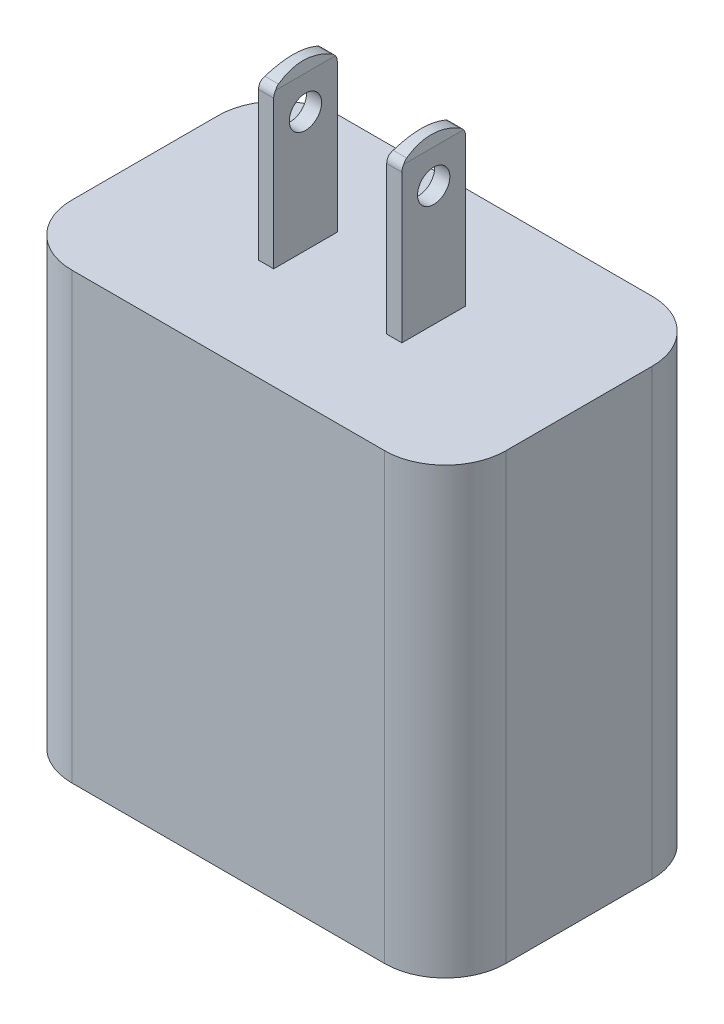
from build123d import *

# Parameters (mm, degrees)
SKETCH2_W           = 43
SKETCH2_H           = 26.5
BOSS_EXTRUDE1_DEPTH = 44
SKETCH3_W           = 12.2
SKETCH3_H           = 4.8
CUT_EXTRUDE1_DEPTH  = 10
SKETCH4_W           = 1.5
SKETCH4_H           = 6.3
BOSS_EXTRUDE2_DEPTH = 16.2
SKETCH5_R           = 1.6
CUT_EXTRUDE2_DEPTH  = 16.2
CUT_EXTRUDE3_DEPTH  = 16.2
CUT_EXTRUDE4_DEPTH  = 16.2
FILLET1_R           = 1
FILLET2_R           = 6
SKETCH8_W           = 10.2
SKETCH8_H           = 1.5
BOSS_EXTRUDE3_DEPTH = 9
CHAMFER1_SIZE       = 0.4


with BuildPart() as part:
    # Sketch2 → Boss-Extrude1 (new body)
    with BuildSketch(Plane(origin=(0, 0, 0), x_dir=(1, 0, 0), z_dir=(0, 1, 0))):
        Rectangle(SKETCH2_W, SKETCH2_H)
    extrude(amount=BOSS_EXTRUDE1_DEPTH)

    # Sketch3 → Cut-Extrude1 (cut)
    with BuildSketch(Plane.XZ):
        Rectangle(SKETCH3_W, SKETCH3_H)
    extrude(amount=-CUT_EXTRUDE1_DEPTH, mode=Mode.SUBTRACT)

    # Sketch4 → Boss-Extrude2 (add)
    with BuildSketch(Plane(origin=(0, 44, 0), x_dir=(1, 0, 0), z_dir=(0, 1, 0))):
        with Locations((-6.35, 0)):
            Rectangle(SKETCH4_W, SKETCH4_H)
        with Locations((6.35, 0)):
            Rectangle(SKETCH4_W, SKETCH4_H)
    extrude(amount=BOSS_EXTRUDE2_DEPTH)

    # Sketch5 → Cut-Extrude2 (cut)
    with BuildSketch(Plane(origin=(7.1, 0, 0), x_dir=(0, 0, -1), z_dir=(1, 0, 0))):
        with Locations((0, 55.9)):
            Circle(SKETCH5_R)
    extrude(amount=-CUT_EXTRUDE2_DEPTH, mode=Mode.SUBTRACT)

    # Sketch6 → Cut-Extrude3 (cut)
    with BuildSketch(Plane(origin=(0, 0, -3.15), x_dir=(-1, 0, 0), z_dir=(0, 0, -1))):
        Polygon((-6.85, 60.2), (-5.85, 60.2), (-5.6, 59.231754163), (-5.6, 60.384988015), (-7.1, 60.384988015), (-7.1, 59.231754163), align=None)
    cut_extrude3 = extrude(amount=-CUT_EXTRUDE3_DEPTH, mode=Mode.SUBTRACT)

    # Mirror1: Cut-Extrude3 across plane
    add(cut_extrude3.mirror(Plane(origin=(0, 0, 0), x_dir=(0, 0, 1), z_dir=(1, 0, 0))), mode=Mode.SUBTRACT)

    # Sketch7 → Cut-Extrude4 (cut)
    with BuildSketch(Plane(origin=(7.1, 0, 0), x_dir=(0, 0, -1), z_dir=(1, 0, 0))):
        with BuildLine():
            Line((-3.15, 59.231754163), (-3.15, 61.207063701))
            Line((-3.15, 61.207063701), (3.15, 61.207063701))
            Line((3.15, 61.207063701), (3.15, 59.231754163))
            add(Edge.make_bspline(
                [(-3.15, 59.231754163), (0, 61.121756778), (3.15, 59.231754163)],
                knots=[0, 0, 0, 1, 1, 1], degree=2))
        make_face()
    extrude(amount=-CUT_EXTRUDE4_DEPTH, mode=Mode.SUBTRACT)

    # Fillet1
    fillet1_edges = [part.edges().sort_by_distance(p)[0] for p in [
        (6.35, 59.231754163, -3.15),
        (-6.35, 59.231754163, -3.15),
        (-6.35, 59.231754163, 3.15),
        (6.35, 59.231754163, 3.15),
    ]]
    fillet(fillet1_edges, radius=FILLET1_R)

    # Fillet2
    fillet2_edges = [part.edges().sort_by_distance(p)[0] for p in [
        (21.5, 22, 13.25),
        (-21.5, 22, 13.25),
        (-21.5, 22, -13.25),
        (21.5, 22, -13.25),
    ]]
    fillet(fillet2_edges, radius=FILLET2_R)

    # Sketch8 → Boss-Extrude3 (add)
    with BuildSketch(Plane.XZ.offset(-10)):
        with Locations((0, 0.95)):
            Rectangle(SKETCH8_W, SKETCH8_H)
    extrude(amount=BOSS_EXTRUDE3_DEPTH)

    # Chamfer1
    chamfer1_edges = [part.edges().sort_by_distance(p)[0] for p in [
        (0, 1, 1.7),
        (-5.1, 1, 0.95),
        (0, 1, 0.2),
        (5.1, 1, 0.95),
    ]]
    chamfer(chamfer1_edges, length=CHAMFER1_SIZE)


solid = part.part
